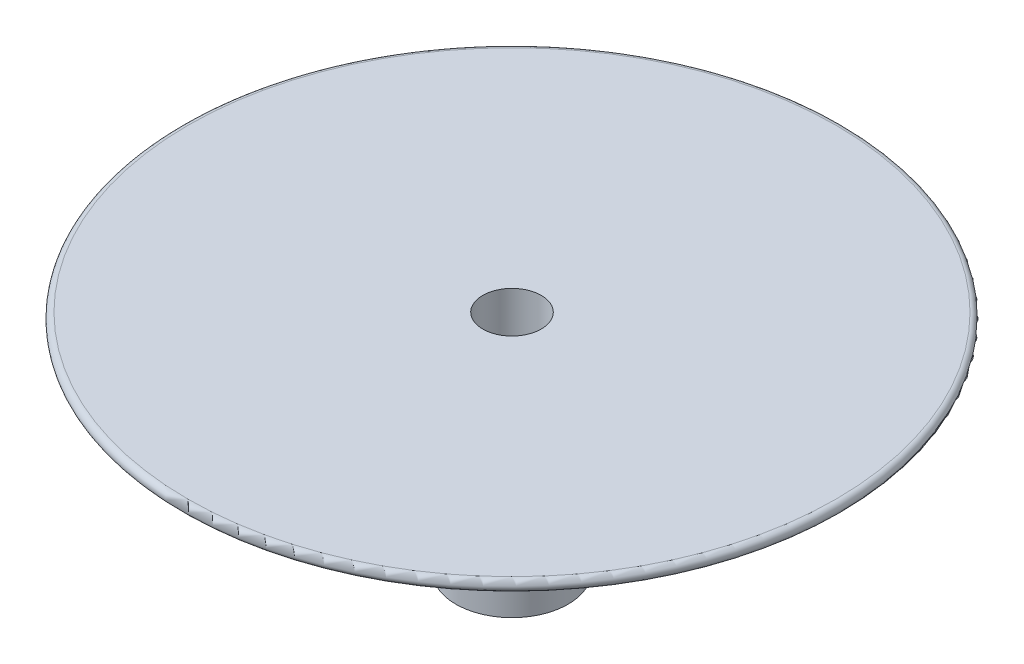
from build123d import *

# Parameters (mm, degrees)
SKETCH2_R          = 2.6
CUT_EXTRUDE1_DEPTH = 48.328372824
FILLET1_R          = 0.5


with BuildPart() as part:
    # Sketch1 → Revolve1 (revolve)
    with BuildSketch(Plane.XY, mode=Mode.PRIVATE) as revolve1_sk:
        with BuildLine():
            Line((0, 10), (0, 0))
            Line((0, 0), (0, -10))
            Line((0, -10), (5, -10))
            Line((5, -10), (5, 0))
            ThreePointArc((5, 0), (18.359605006, 3.242115389), (30.331294682, 10))
            Line((30.331294682, 10), (0, 10))
        make_face()
    revolve(revolve1_sk.sketch.rotate(Axis((0, 10, 0), (0, -1, 0)), 180), axis=Axis((0, 10, 0), (0, -1, 0)))

    # Sketch2 → Cut-Extrude1 (cut, through all)
    with BuildSketch(Plane(origin=(0, 10, 0), x_dir=(1, 0, 0), z_dir=(0, 1, 0))):
        with Locations(Location((0, 0, 0), (0, 0, 180))):
            Circle(SKETCH2_R)
    extrude(amount=-CUT_EXTRUDE1_DEPTH, mode=Mode.SUBTRACT)

    # Fillet1
    fillet1_edges = [part.edges().sort_by_distance(p)[0] for p in [
        (30.331294682, 10, 0),
    ]]
    fillet(fillet1_edges, radius=FILLET1_R)


solid = part.part
